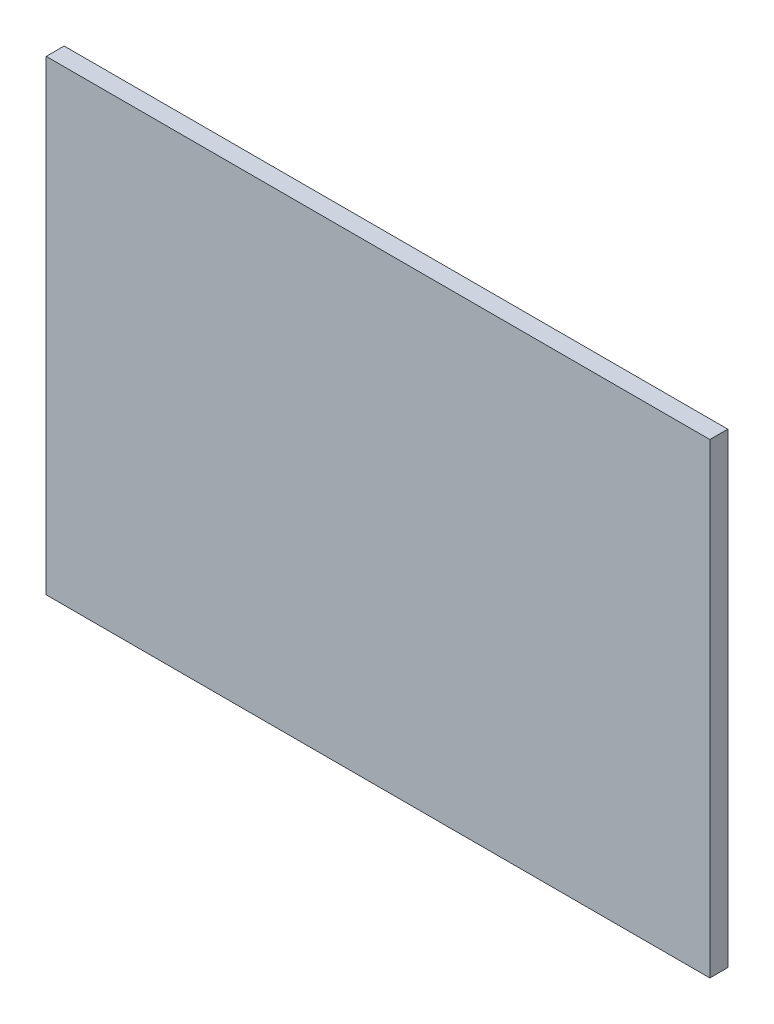
from build123d import *

# Parameters (mm, degrees)
CROQUIS1_W              = 74
CROQUIS1_H              = 52
SALIENTE_EXTRUIR1_DEPTH = 2


with BuildPart() as part:
    # Croquis1 → Saliente-Extruir1 (new body)
    with BuildSketch(Plane.XY):
        Rectangle(CROQUIS1_W, CROQUIS1_H)
    extrude(amount=SALIENTE_EXTRUIR1_DEPTH)


solid = part.part
